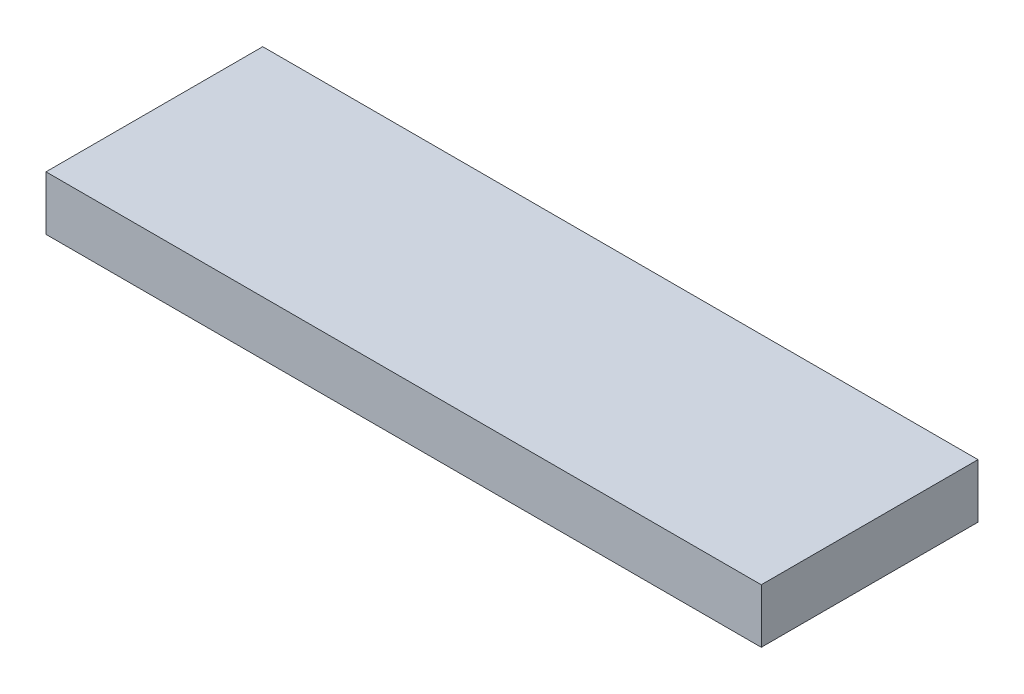
from build123d import *

# Parameters (mm, degrees)
SKETCH1_W          = 83.82
SKETCH1_H          = 25.4
BOX_DEPTH          = 6.35
CUT_EXTRUDE1_DEPTH = 3.175


with BuildPart() as part:
    # Sketch1 → Box (new body)
    with BuildSketch(Plane(origin=(0, 0, 0), x_dir=(1, 0, 0), z_dir=(0, 1, 0))):
        Rectangle(SKETCH1_W, SKETCH1_H)
    extrude(amount=BOX_DEPTH)

    # Sketch5 → Cut-Extrude1 (cut)
    with BuildSketch(Plane(origin=(0, 0, 0), x_dir=(1, 0, 0), z_dir=(0, 1, 0))):
        with BuildLine():
            Line((-13.354872806, -5.08), (-20.935127194, -5.08))
            ThreePointArc((-20.935127194, -5.08), (-26.015127194, 0), (-20.935127194, 5.08))
            Line((-20.935127194, 5.08), (-13.354872806, 5.08))
            ThreePointArc((-13.354872806, 5.08), (-8.274872806, 0), (-13.354872806, -5.08))
        make_face()
        with BuildLine():
            Line((13.354872806, -5.08), (20.935127194, -5.08))
            ThreePointArc((20.935127194, -5.08), (26.015127194, 0), (20.935127194, 5.08))
            Line((20.935127194, 5.08), (13.354872806, 5.08))
            ThreePointArc((13.354872806, 5.08), (8.274872806, 0), (13.354872806, -5.08))
        make_face()
    extrude(amount=CUT_EXTRUDE1_DEPTH, mode=Mode.SUBTRACT)


solid = part.part
